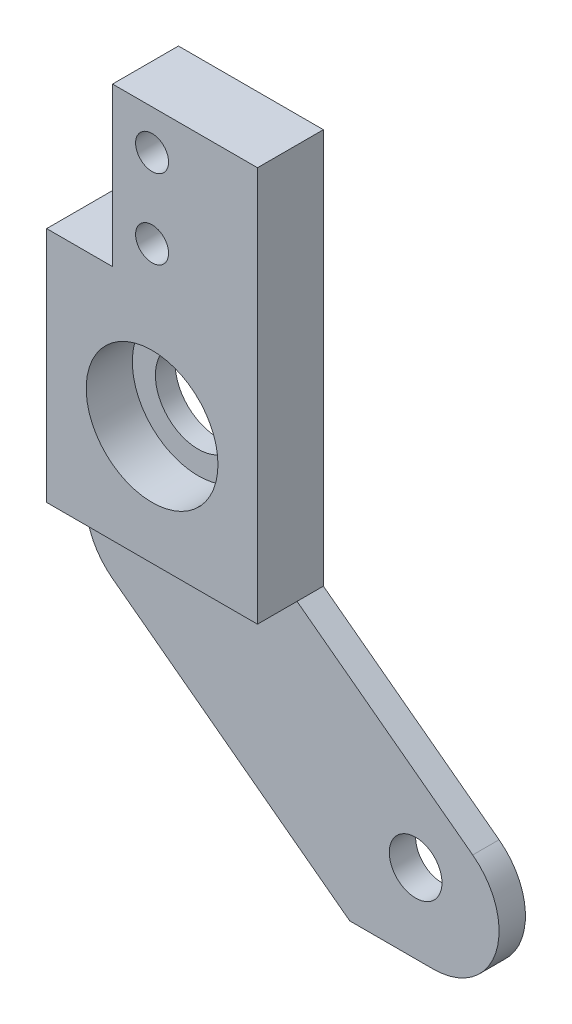
from build123d import *

# Parameters (mm, degrees)
EXTRUDE1_DEPTH        = 5
SKETCH8_R             = 5
EXTRUDE6_DEPTH        = 3.5
SKETCH9_R             = 3.25
EXTRUDE7_DEPTH        = 1.5
SKETCH14_W            = 5
SKETCH14_H            = 12
EXTRUDE12_DEPTH       = 5
SKETCH11_R            = 1.25
EXTRUDE9_DEPTH        = 5
FILLET1_R             = 5
SKETCH12_R            = 2
EXTRUDE10_DEPTH       = 5
EXTRUDE11_DEPTH       = 3
M3_TAPPED_HOLE1_D     = 2.5
M3_TAPPED_HOLE1_DEPTH = 8
M3_TAPPED_HOLE1_TIP   = 0.751075774


with BuildPart() as part:
    # Sketch1 → Extrude1 (new body)
    with BuildSketch(Plane.XY):
        Polygon((-8, -13), (12, -28), (33.333333333, -28), (8, -9), (8, 21), (-8, 21), align=None)
    extrude(amount=EXTRUDE1_DEPTH)

    # Sketch8 → Extrude6 (cut)
    with BuildSketch(Plane.XY.offset(5)):
        Circle(SKETCH8_R)
    extrude(amount=-EXTRUDE6_DEPTH, mode=Mode.SUBTRACT)

    # Sketch9 → Extrude7 (cut)
    with BuildSketch(Plane.XY.offset(1.5)):
        Circle(SKETCH9_R)
    extrude(amount=-EXTRUDE7_DEPTH, mode=Mode.SUBTRACT)

    # Sketch14 → Extrude12 (cut)
    with BuildSketch(Plane.XY.offset(5)):
        with Locations((-5.5, 15)):
            Rectangle(SKETCH14_W, SKETCH14_H)
    extrude(amount=-EXTRUDE12_DEPTH, mode=Mode.SUBTRACT)

    # Sketch11 → Extrude9 (cut)
    with BuildSketch(Plane(origin=(0, 0, 0), x_dir=(-1, 0, 0), z_dir=(0, 0, -1))):
        with Locations((0, 18)):
            Circle(SKETCH11_R)
        with Locations((0, 12)):
            Circle(SKETCH11_R)
    extrude(amount=-EXTRUDE9_DEPTH, mode=Mode.SUBTRACT)

    # Fillet1
    fillet1_edges = [part.edges().sort_by_distance(p)[0] for p in [
        (-8, -13, 2.5),
        (33.333333333, -28, 2.5),
    ]]
    fillet(fillet1_edges, radius=FILLET1_R)

    # Sketch12 → Extrude10 (cut)
    with BuildSketch(Plane.XY.offset(5)):
        with Locations((17, -22)):
            Circle(SKETCH12_R)
    extrude(amount=-EXTRUDE10_DEPTH, mode=Mode.SUBTRACT)

    # Sketch13 → Extrude11 (cut)
    with BuildSketch(Plane.XY.offset(5)):
        with BuildLine():
            Line((12, -28), (18.333333333, -28))
            ThreePointArc((18.333333333, -28), (23.076749824, -24.58113883), (21.333333333, -19))
            Line((21.333333333, -19), (8, -9))
            Line((8, -9), (-8, -9))
            Line((-8, -9), (-8, -10.5))
            ThreePointArc((-8, -10.5), (-7.472135955, -12.736067977), (-6, -14.5))
            Line((-6, -14.5), (12, -28))
        make_face()
    extrude(amount=-EXTRUDE11_DEPTH, mode=Mode.SUBTRACT)

    # M3 Tapped Hole1
    with Locations(Plane(origin=(0, 18, 5), x_dir=(1, 0, 0), z_dir=(0, 0, 1))):
        with Locations((0, 0), (0, -6)):
            Hole(M3_TAPPED_HOLE1_D / 2, depth=M3_TAPPED_HOLE1_DEPTH)
            with Locations((0, 0, -(M3_TAPPED_HOLE1_DEPTH + M3_TAPPED_HOLE1_TIP / 2))):  # 118° drill point
                Cone(0, M3_TAPPED_HOLE1_D / 2, M3_TAPPED_HOLE1_TIP, mode=Mode.SUBTRACT)


solid = part.part
